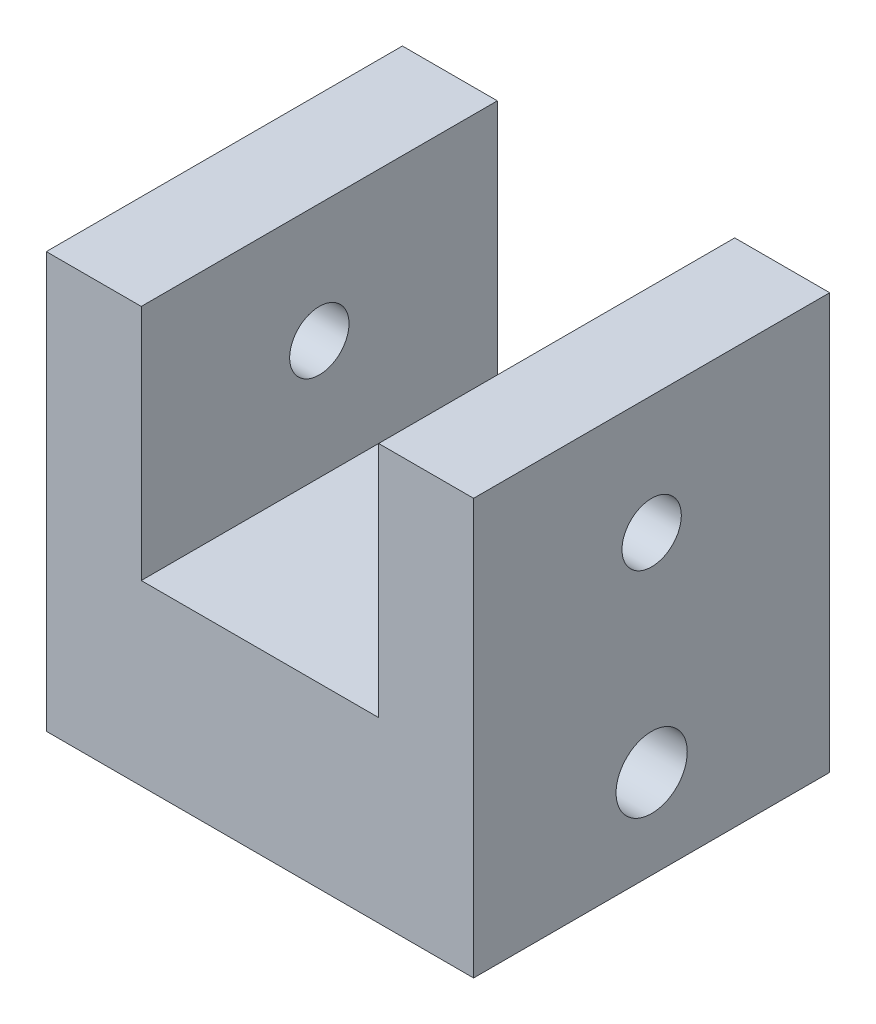
from build123d import *

# Parameters (mm, degrees)
DODANIE_WYCI_GNI_CIE1_DEPTH = 30
SZKIC2_R                    = 3
SZKIC2_R_2                  = 2.5
WYTNIJ_WYCI_GNI_CIE1_DEPTH  = 51.950956811


with BuildPart() as part:
    # Szkic1 → Dodanie-wyciągnięcie1 (new body)
    with BuildSketch(Plane.XY):
        Polygon((-8, 20), (-8, -15), (28, -15), (28, 20), (20, 20), (20, 0), (0, 0), (0, 20), align=None)
    extrude(amount=DODANIE_WYCI_GNI_CIE1_DEPTH)

    # Szkic2 → Wytnij-wyciągnięcie1 (cut, through all)
    with BuildSketch(Plane(origin=(28, 0, 0), x_dir=(0, 0, -1), z_dir=(1, 0, 0))):
        with Locations((-15, -7.5)):
            Circle(SZKIC2_R)
        with Locations((-15, 10)):
            Circle(SZKIC2_R_2)
    extrude(amount=-WYTNIJ_WYCI_GNI_CIE1_DEPTH, mode=Mode.SUBTRACT)


solid = part.part
